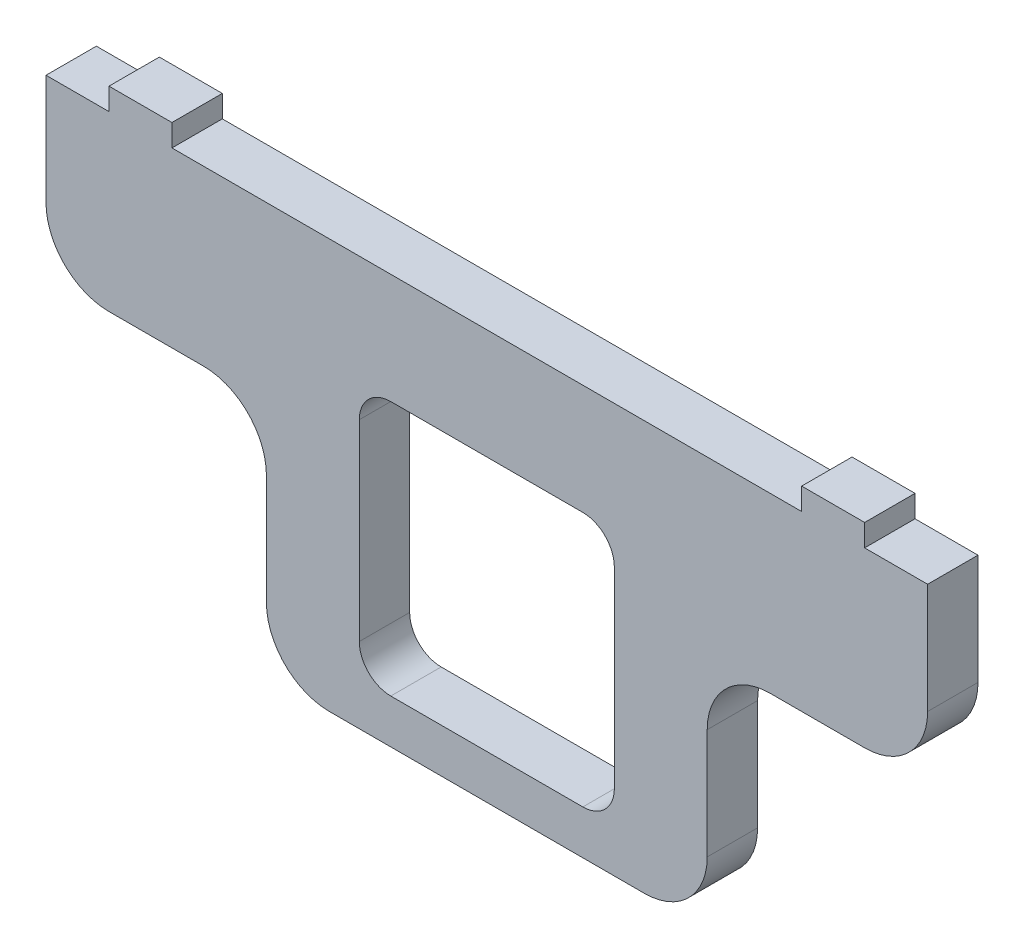
from build123d import *

# Parameters (mm, degrees)
SKETCH_1_W      = 81
SKETCH_1_H      = 81
EXTRUDE_1_DEPTH = 8
FILLET_1_R      = 20
FILLET_2_R      = 10


with BuildPart() as part:
    # 草图1 → 凸台-拉伸1 (new, symmetric)
    with BuildSketch(Plane.XY):
        Polygon((-70, 0), (70, 0), (70, 75), (140, 75), (140, 130), (120, 130), (120, 137), (100, 137), (100, 130), (-100, 130), (-100, 137), (-120, 137), (-120, 130), (-140, 130), (-140, 75), (-70, 75), align=None)
        with Locations((0, 54.5)):
            Rectangle(SKETCH_1_W, SKETCH_1_H, mode=Mode.SUBTRACT)
    extrude(amount=EXTRUDE_1_DEPTH, both=True)

    # 圆角1
    fillet_1_edges = [part.edges().sort_by_distance(p)[0] for p in [
        (70, 0, 0),
        (-70, 0, 0),
        (-70, 75, 0),
        (-140, 75, 0),
        (140, 75, 0),
        (70, 75, 0),
    ]]
    fillet(fillet_1_edges, radius=FILLET_1_R)

    # 圆角2
    fillet_2_edges = [part.edges().sort_by_distance(p)[0] for p in [
        (-40.5, 95, 0),
        (-40.5, 14, 0),
        (40.5, 14, 0),
        (40.5, 95, 0),
    ]]
    fillet(fillet_2_edges, radius=FILLET_2_R)


solid = part.part
